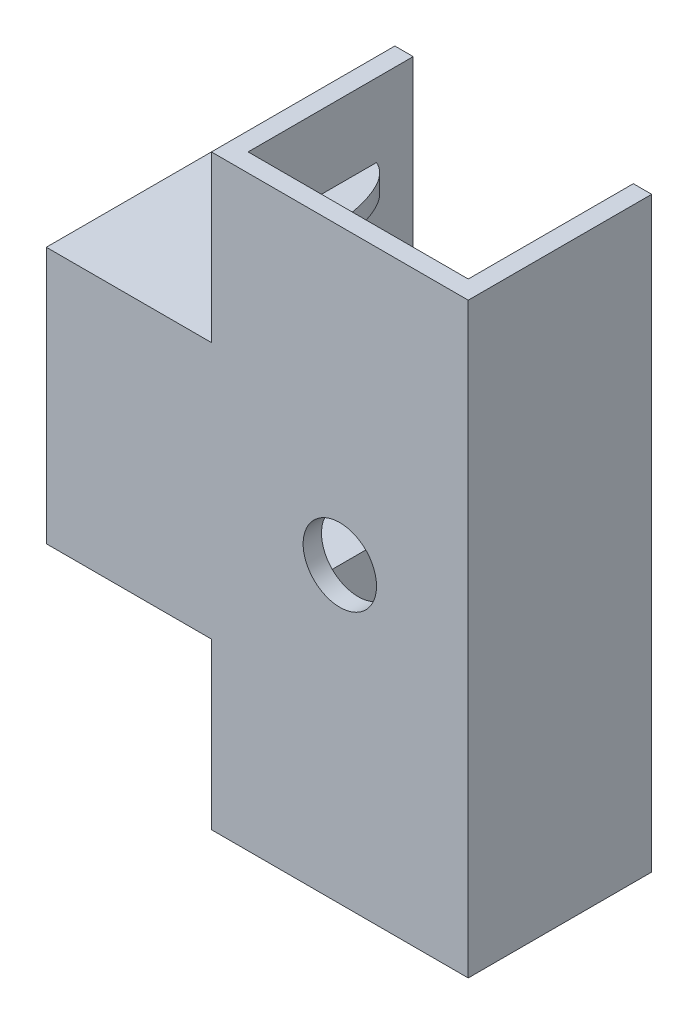
from build123d import *

# Parameters (mm, degrees)
CROQUIS1_R                   = 2000
SALIENTE_EXTRUIR1_DEPTH      = 1000
SALIENTE_EXTRUIR2_DEPTH      = 10000
SALIENTE_EXTRUIR3_DEPTH      = 500
SALIENTE_EXTRUIR3_DEPTH_BACK = 500
SALIENTE_EXTRUIR4_DEPTH      = 500
SALIENTE_EXTRUIR4_DEPTH_BACK = 500
SALIENTE_EXTRUIR5_DEPTH      = 500
SALIENTE_EXTRUIR5_DEPTH_BACK = 500


with BuildPart() as part:
    # Croquis1 → Saliente-Extruir1 (new body)
    with BuildSketch(Plane.XY):
        Polygon((117743.416897498, 161337.836627923), (117743.416897498, 152337.836627923), (131743.416897498, 152337.836627923), (131743.416897498, 184337.836627923), (117743.416897498, 184337.836627923), (117743.416897498, 175337.836627923), (108743.416897498, 175337.836627923), (108743.416897498, 161337.836627923), align=None)
        with Locations((124743.416897498, 168337.836627923)):
            Circle(CROQUIS1_R, mode=Mode.SUBTRACT)
    extrude(amount=-SALIENTE_EXTRUIR1_DEPTH)

    # Croquis1<6> → Saliente-Extruir2 (add)
    with BuildSketch(Plane.XY):
        Polygon((117743.416897498, 161337.836627923), (117743.416897498, 152337.836627923), (118743.416897498, 152337.836627923), (118743.416897498, 162337.836627923), (108743.416897498, 162337.836627923), (108743.416897498, 161337.836627923), align=None)
        with BuildLine():
            Line((130743.416897498, 152337.836627923), (131743.416897498, 152337.836627923))
            Line((131743.416897498, 152337.836627923), (131743.416897498, 184337.836627923))
            Line((131743.416897498, 184337.836627923), (130743.416897498, 184337.836627923))
            Line((130743.416897498, 184337.836627923), (130743.416897498, 170237.836627923))
            Line((130743.416897498, 170237.836627923), (129243.416897498, 170237.836627923))
            ThreePointArc((129243.416897498, 170237.836627923), (128253.467403837, 169827.786121585), (127843.416897498, 168837.836627923))
            Line((127843.416897498, 168837.836627923), (127843.416897498, 167837.836627923))
            ThreePointArc((127843.416897498, 167837.836627923), (128253.467403837, 166847.887134262), (129243.416897498, 166437.836627923))
            Line((129243.416897498, 166437.836627923), (130743.416897498, 166437.836627923))
            Line((130743.416897498, 166437.836627923), (130743.416897498, 152337.836627923))
        make_face()
        Polygon((108743.416897498, 174337.836627923), (118743.416897498, 174337.836627923), (118743.416897498, 184337.836627923), (117743.416897498, 184337.836627923), (117743.416897498, 175337.836627923), (108743.416897498, 175337.836627923), align=None)
    extrude(amount=-SALIENTE_EXTRUIR2_DEPTH)

    # Croquis2 → Saliente-Extruir3 (add, two sides: drawn at the far end of the back side and taken through both)
    with BuildSketch(Plane(origin=(0, 156837.836627923, 0), x_dir=(1, 0, 0), z_dir=(0, 1, 0)).offset(-SALIENTE_EXTRUIR3_DEPTH_BACK)):
        with BuildLine():
            add(Edge.make_bspline(
                [(118743.416897498, 8000), (120739.811138244, 7120.578794783), (120743.416897498, 1000)],
                knots=[0, 0, 0, 0.514460755, 0.514460755, 0.514460755], degree=2))
            Line((118743.416897498, 8000), (118743.416897498, 1000))
            Line((118743.416897498, 1000), (120743.416897498, 1000))
        make_face()
        with BuildLine():
            Line((130743.416897498, 1000), (130743.416897498, 8000))
            add(Edge.make_bspline(
                [(130743.416897498, 8000), (128761.675222051, 7234.348262256), (128743.416897498, 1000)],
                knots=[0, 0, 0, 0.590989184, 0.590989184, 0.590989184], degree=2))
            Line((128743.416897498, 1000), (130743.416897498, 1000))
        make_face()
    extrude(amount=SALIENTE_EXTRUIR3_DEPTH + SALIENTE_EXTRUIR3_DEPTH_BACK)

    # Croquis3 → Saliente-Extruir4 (add, two sides: drawn at the far end of the back side and taken through both)
    with BuildSketch(Plane(origin=(0, 179837.836627923, 0), x_dir=(1, 0, 0), z_dir=(0, 1, 0)).offset(-SALIENTE_EXTRUIR4_DEPTH_BACK)):
        with BuildLine():
            add(Edge.make_bspline(
                [(130743.416897498, 8000), (128761.675222051, 7234.348262256), (128743.416897498, 1000)],
                knots=[0, 0, 0, 1, 1, 1], degree=2))
            Line((128743.416897498, 1000), (130743.416897498, 1000))
            Line((130743.416897498, 1000), (130743.416897498, 8000))
        make_face()
        with BuildLine():
            Line((118743.416897498, 8000), (118743.416897498, 1000))
            Line((118743.416897498, 1000), (120743.416897498, 1000))
            add(Edge.make_bspline(
                [(118743.416897498, 8000), (120739.811138244, 7120.578794783), (120743.416897498, 1000)],
                knots=[0, 0, 0, 1, 1, 1], degree=2))
        make_face()
    extrude(amount=SALIENTE_EXTRUIR4_DEPTH + SALIENTE_EXTRUIR4_DEPTH_BACK)

    # Croquis4 → Saliente-Extruir5 (add, two sides: drawn at the far end of the back side and taken through both)
    with BuildSketch(Plane(origin=(113243.416897498, 0, 0), x_dir=(0, 0, -1), z_dir=(1, 0, 0)).offset(-SALIENTE_EXTRUIR5_DEPTH_BACK)):
        with BuildLine():
            Line((8000, 174337.836627923), (0, 174337.836627923))
            Line((0, 174337.836627923), (0, 172337.836627923))
            add(Edge.make_bspline(
                [(8000, 174337.836627923), (6599.854554041, 172118.74354217), (0, 172337.836627923)],
                knots=[0, 0, 0, 0.64837766, 0.64837766, 0.64837766], degree=2))
        make_face()
        with BuildLine():
            add(Edge.make_bspline(
                [(8000, 162337.836627923), (6698.658965378, 164240.824079883), (0, 164337.836627923)],
                knots=[0, 0, 0, 0.707529781, 0.707529781, 0.707529781], degree=2))
            Line((0, 164337.836627923), (0, 162337.836627923))
            Line((0, 162337.836627923), (8000, 162337.836627923))
        make_face()
    extrude(amount=SALIENTE_EXTRUIR5_DEPTH + SALIENTE_EXTRUIR5_DEPTH_BACK)


solid = part.part
